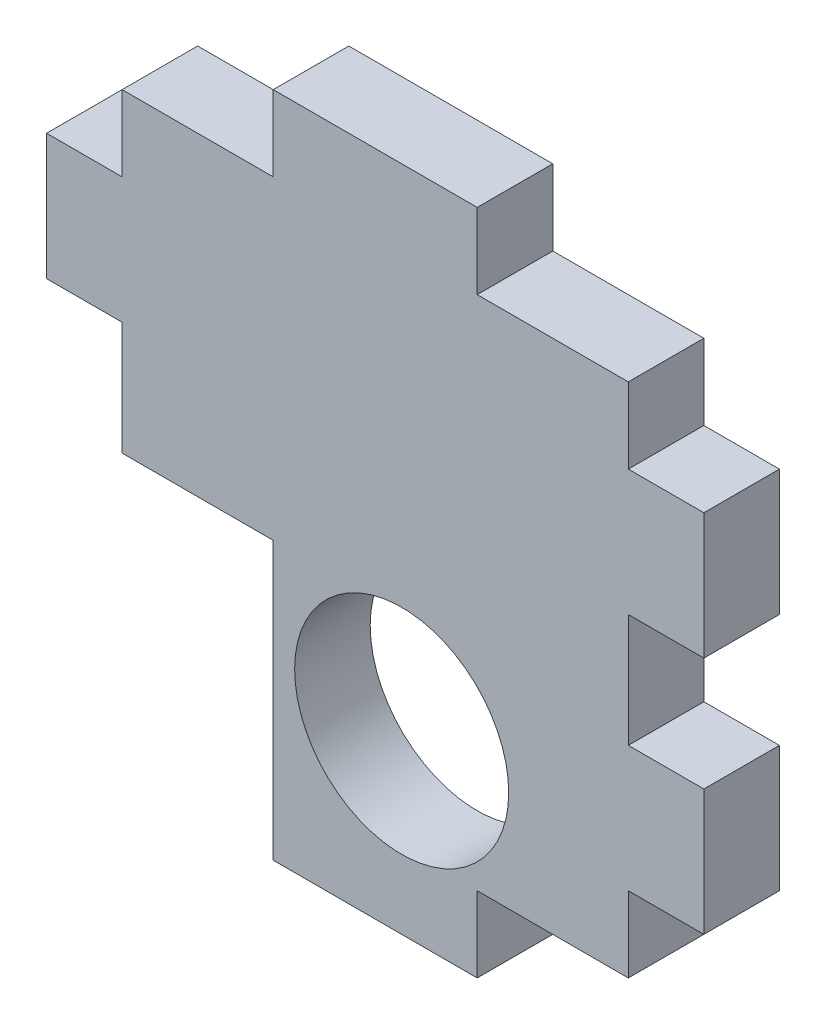
from build123d import *

# Parameters (mm, degrees)
BASE_DEPTH            = 3
ESBO_O1_R             = 4.25
PASSAGEMLEDELDR_DEPTH = 3


with BuildPart() as part:
    # BaseEsboco → Base (new body)
    with BuildSketch(Plane.XY):
        Polygon((0, 0), (6, 0), (6, -3), (14.1, -3), (14.1, 0), (20.1, 0), (20.1, 3), (23.1, 3), (23.1, 8), (20.1, 8), (20.1, 12.5), (23.1, 12.5), (23.1, 17.5), (20.1, 17.5), (20.1, 20.5), (14.1, 20.5), (14.1, 23.5), (6, 23.5), (6, 20.5), (0, 20.5), (0, 17.5), (-3, 17.5), (-3, 12.5), (0, 12.5), (0, 8), (-3, 8), (-3, 3), (0, 3), align=None)
    extrude(amount=BASE_DEPTH)

    # Esboço1 → PassagemLEDeLDR (cut)
    with BuildSketch(Plane.XY.offset(3)):
        with Locations((11.1, 4)):
            Circle(ESBO_O1_R)
        Polygon((0, 8), (6, 8), (6, 0), (0, 0), (0, 3), (-3, 3), (-3, 8), align=None)
    extrude(amount=-PASSAGEMLEDELDR_DEPTH, mode=Mode.SUBTRACT)


solid = part.part
